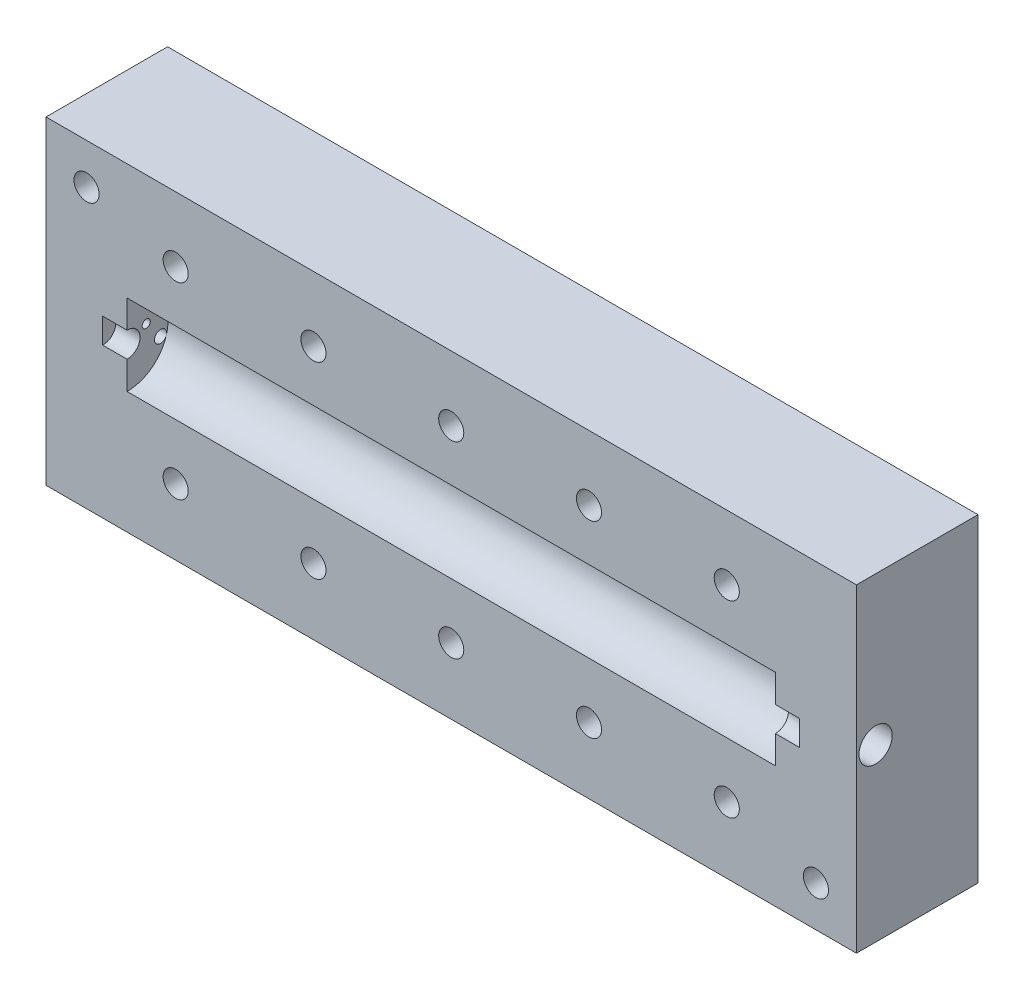
from build123d import *

# Parameters (mm, degrees)
SKIZZE2_W                            = 100
SKIZZE2_H                            = 39.364160046
AUFSATZ_LINEAR_AUSTRAGEN1_DEPTH      = 30
SCHNITT_LINEAR_AUSTRAGEN1_DEPTH      = 40
SCHNITT_LINEAR_AUSTRAGEN1_DEPTH_BACK = 40
SKIZZE10_R                           = 5
SKIZZE17_R                           = 1.55
SCHNITT_LINEAR_AUSTRAGEN2_DEPTH      = 3
SKIZZE24_R                           = 1.55
SCHNITT_LINEAR_AUSTRAGEN4_DEPTH      = 112.577493681
SKIZZE37_R                           = 0.736865544
SCHNITT_LINEAR_AUSTRAGEN9_DEPTH      = 112.577493681
SKIZZE40_R                           = 2.1
SCHNITT_LINEAR_AUSTRAGEN10_DEPTH     = 6
SKIZZE42_R                           = 0.75
SCHNITT_LINEAR_AUSTRAGEN12_DEPTH     = 10
SKIZZE46_R                           = 2.85
SCHNITT_LINEAR_AUSTRAGEN15_DEPTH     = 10
SCHNITT_LINEAR_START                 = -5
SCHNITT_LINEAR_AUSTRAGEN25_DEPTH     = 2.7
LINEARES_MUSTER1_COUNT               = 5
LINEARES_MUSTER1_PITCH               = 17
SPIEGELN2_COPY_1_SKETCH_R            = 2.85
SPIEGELN2_COPY_1_DEPTH               = 10
SPIEGELN2_COPY_2_SKETCH_R            = 2.85
SPIEGELN2_COPY_2_DEPTH               = 10
SPIEGELN2_COPY_3_SKETCH_R            = 2.85
SPIEGELN2_COPY_3_DEPTH               = 10
SPIEGELN2_COPY_4_SKETCH_R            = 2.85
SPIEGELN2_COPY_4_DEPTH               = 10
SPIEGELN2_START                      = -5
SPIEGELN2_COPY_5_DEPTH               = 2.7
SPIEGELN2_COPY_6_DEPTH               = 2.7
SPIEGELN2_COPY_7_DEPTH               = 2.7
SPIEGELN2_COPY_8_DEPTH               = 2.7
SKIZZE51_R                           = 1.55
SCHNITT_LINEAR_AUSTRAGEN26_DEPTH     = 112.577493681
SKIZZE55_R                           = 0.5
SCHNITT_LINEAR_AUSTRAGEN28_DEPTH     = 112.577493681
SKIZZE59_R                           = 2.05
SCHNITT_LINEAR_AUSTRAGEN30_DEPTH     = 5
FASE1_SIZE                           = 1
FASE2_SIZE                           = 1
ABSPALTEN3_SURFACE_1_BACK            = 112.577
ABSPALTEN3_SURFACE_1_DEPTH           = 225.154


with BuildPart() as part:
    # Skizze2 → Aufsatz-Linear austragen1 (new body)
    with BuildSketch(Plane.XY):
        with Locations((50, 19.682080023)):
            Rectangle(SKIZZE2_W, SKIZZE2_H)
    extrude(amount=AUFSATZ_LINEAR_AUSTRAGEN1_DEPTH)

    # Skizze10 → Schnitt-Linear austragen1 (cut, two sides: drawn at the far end of the back side and taken through both)
    with BuildSketch(Plane.ZY.offset(-50).offset(-SCHNITT_LINEAR_AUSTRAGEN1_DEPTH_BACK)):
        with Locations((14.945770016, 20.027045739)):
            Circle(SKIZZE10_R)
    extrude(amount=SCHNITT_LINEAR_AUSTRAGEN1_DEPTH + SCHNITT_LINEAR_AUSTRAGEN1_DEPTH_BACK, mode=Mode.SUBTRACT)

    # Skizze17 → Schnitt-Linear austragen2 (cut)
    with BuildSketch(Plane.ZY.offset(-90)):
        with Locations((14.945770016, 20.027045739)):
            Circle(SKIZZE17_R)
    schnitt_linear_austragen2 = extrude(amount=-SCHNITT_LINEAR_AUSTRAGEN2_DEPTH, mode=Mode.SUBTRACT)

    # Spiegeln1: Schnitt-Linear austragen2 across plane
    add(schnitt_linear_austragen2.mirror(Plane.ZY.offset(-50)), mode=Mode.SUBTRACT)

    # Skizze24 → Schnitt-Linear austragen4 (cut, through all)
    with BuildSketch(Plane.XY.offset(30)):
        with Locations((16, 31.364160046)):
            Circle(SKIZZE24_R)
        with Locations((33, 31.364160046)):
            Circle(SKIZZE24_R)
        with Locations((50, 31.364160046)):
            Circle(SKIZZE24_R)
        with Locations((67, 31.364160046)):
            Circle(SKIZZE24_R)
        with Locations((84, 31.364160046)):
            Circle(SKIZZE24_R)
    schnitt_linear_austragen4 = extrude(amount=-SCHNITT_LINEAR_AUSTRAGEN4_DEPTH, mode=Mode.SUBTRACT)

    # Skizze37 → Schnitt-Linear austragen9 (cut, through all)
    with BuildSketch(Plane(origin=(100, 0, 0), x_dir=(0, 0, -1), z_dir=(1, 0, 0))):
        with Locations((-18.924590299, 18.633559666)):
            Circle(SKIZZE37_R)
    extrude(amount=-SCHNITT_LINEAR_AUSTRAGEN9_DEPTH, mode=Mode.SUBTRACT)

    # Skizze40 → Schnitt-Linear austragen10 (cut)
    with BuildSketch(Plane(origin=(100, 0, 0), x_dir=(0, 0, -1), z_dir=(1, 0, 0))):
        with Locations((-18.924590299, 18.633559666)):
            Circle(SKIZZE40_R)
    extrude(amount=-SCHNITT_LINEAR_AUSTRAGEN10_DEPTH, mode=Mode.SUBTRACT)

    # Skizze42 → Schnitt-Linear austragen12 (cut)
    with BuildSketch(Plane.ZY):
        with Locations((10.86415918, 18.842582577)):
            Circle(SKIZZE42_R)
    extrude(amount=-SCHNITT_LINEAR_AUSTRAGEN12_DEPTH, mode=Mode.SUBTRACT)

    # Skizze46 → Schnitt-Linear austragen15 (cut)
    with BuildSketch(Plane(origin=(0, 0, 0), x_dir=(-1, 0, 0), z_dir=(0, 0, -1))):
        with Locations((-84, 31.364160046)):
            Circle(SKIZZE46_R)
    schnitt_linear_austragen15 = extrude(amount=-SCHNITT_LINEAR_AUSTRAGEN15_DEPTH, mode=Mode.SUBTRACT)

    # Skizze50 → Schnitt-Linear austragen25 (cut)
    with BuildSketch(Plane.XY.offset(30).offset(SCHNITT_LINEAR_START)):
        Polygon((81.15, 33.009608314), (81.15, 39.364160046), (86.85, 39.364160046), (86.85, 33.009608314), (86.85, 29.718711779), (84, 28.073263512), (81.15, 29.718711779), align=None)
    schnitt_linear_austragen25 = extrude(amount=-SCHNITT_LINEAR_AUSTRAGEN25_DEPTH, mode=Mode.SUBTRACT)

    # Lineares Muster1: Schnitt-Linear austragen15, Schnitt-Linear austragen25 ×5
    with Locations(*[(-i * LINEARES_MUSTER1_PITCH, 0, 0) for i in range(1, LINEARES_MUSTER1_COUNT)]):
        add(schnitt_linear_austragen15, mode=Mode.SUBTRACT)
        add(schnitt_linear_austragen25, mode=Mode.SUBTRACT)

    # Spiegeln2: Schnitt-Linear austragen15, Schnitt-Linear austragen25 across plane
    add(schnitt_linear_austragen15.mirror(Plane.ZX.offset(19.764160046)), mode=Mode.SUBTRACT)
    add(schnitt_linear_austragen25.mirror(Plane.ZX.offset(19.764160046)), mode=Mode.SUBTRACT)

    # Spiegeln2 copy 1 sketch → Spiegeln2 copy 1 (cut)
    with BuildSketch(Plane(origin=(-17, 39.528320093, 0), x_dir=(-1, 0, 0), z_dir=(0, 0, -1))):
        with Locations((-84, -31.364160046)):
            Circle(SPIEGELN2_COPY_1_SKETCH_R)
    extrude(amount=-SPIEGELN2_COPY_1_DEPTH, mode=Mode.SUBTRACT)

    # Spiegeln2 copy 2 sketch → Spiegeln2 copy 2 (cut)
    with BuildSketch(Plane(origin=(-34, 39.528320093, 0), x_dir=(-1, 0, 0), z_dir=(0, 0, -1))):
        with Locations((-84, -31.364160046)):
            Circle(SPIEGELN2_COPY_2_SKETCH_R)
    extrude(amount=-SPIEGELN2_COPY_2_DEPTH, mode=Mode.SUBTRACT)

    # Spiegeln2 copy 3 sketch → Spiegeln2 copy 3 (cut)
    with BuildSketch(Plane(origin=(-51, 39.528320093, 0), x_dir=(-1, 0, 0), z_dir=(0, 0, -1))):
        with Locations((-84, -31.364160046)):
            Circle(SPIEGELN2_COPY_3_SKETCH_R)
    extrude(amount=-SPIEGELN2_COPY_3_DEPTH, mode=Mode.SUBTRACT)

    # Spiegeln2 copy 4 sketch → Spiegeln2 copy 4 (cut)
    with BuildSketch(Plane(origin=(-68, 39.528320093, 0), x_dir=(-1, 0, 0), z_dir=(0, 0, -1))):
        with Locations((-84, -31.364160046)):
            Circle(SPIEGELN2_COPY_4_SKETCH_R)
    extrude(amount=-SPIEGELN2_COPY_4_DEPTH, mode=Mode.SUBTRACT)

    # Spiegeln2 copy 5 sketch → Spiegeln2 copy 5 (cut)
    with BuildSketch(Plane(origin=(-17, 39.528320093, 30), x_dir=(1, 0, 0), z_dir=(0, 0, 1)).offset(SPIEGELN2_START)):
        Polygon((81.15, -33.009608314), (81.15, -39.364160046), (86.85, -39.364160046), (86.85, -33.009608314), (86.85, -29.718711779), (84, -28.073263512), (81.15, -29.718711779), align=None)
    extrude(amount=-SPIEGELN2_COPY_5_DEPTH, mode=Mode.SUBTRACT)

    # Spiegeln2 copy 6 sketch → Spiegeln2 copy 6 (cut)
    with BuildSketch(Plane(origin=(-34, 39.528320093, 30), x_dir=(1, 0, 0), z_dir=(0, 0, 1)).offset(SPIEGELN2_START)):
        Polygon((81.15, -33.009608314), (81.15, -39.364160046), (86.85, -39.364160046), (86.85, -33.009608314), (86.85, -29.718711779), (84, -28.073263512), (81.15, -29.718711779), align=None)
    extrude(amount=-SPIEGELN2_COPY_6_DEPTH, mode=Mode.SUBTRACT)

    # Spiegeln2 copy 7 sketch → Spiegeln2 copy 7 (cut)
    with BuildSketch(Plane(origin=(-51, 39.528320093, 30), x_dir=(1, 0, 0), z_dir=(0, 0, 1)).offset(SPIEGELN2_START)):
        Polygon((81.15, -33.009608314), (81.15, -39.364160046), (86.85, -39.364160046), (86.85, -33.009608314), (86.85, -29.718711779), (84, -28.073263512), (81.15, -29.718711779), align=None)
    extrude(amount=-SPIEGELN2_COPY_7_DEPTH, mode=Mode.SUBTRACT)

    # Spiegeln2 copy 8 sketch → Spiegeln2 copy 8 (cut)
    with BuildSketch(Plane(origin=(-68, 39.528320093, 30), x_dir=(1, 0, 0), z_dir=(0, 0, 1)).offset(SPIEGELN2_START)):
        Polygon((81.15, -33.009608314), (81.15, -39.364160046), (86.85, -39.364160046), (86.85, -33.009608314), (86.85, -29.718711779), (84, -28.073263512), (81.15, -29.718711779), align=None)
    extrude(amount=-SPIEGELN2_COPY_8_DEPTH, mode=Mode.SUBTRACT)

    # Spiegeln3: Schnitt-Linear austragen4 across plane
    add(schnitt_linear_austragen4.mirror(Plane.ZX.offset(19.764160046)), mode=Mode.SUBTRACT)

    # Skizze51 → Schnitt-Linear austragen26 (cut, through all)
    with BuildSketch(Plane.XY.offset(30)):
        with Locations((5, 34.364160046)):
            Circle(SKIZZE51_R)
        with Locations((95, 5)):
            Circle(SKIZZE51_R)
    extrude(amount=-SCHNITT_LINEAR_AUSTRAGEN26_DEPTH, mode=Mode.SUBTRACT)

    # Skizze55 → Schnitt-Linear austragen28 (cut, through all)
    with BuildSketch(Plane(origin=(100, 0, 0), x_dir=(0, 0, -1), z_dir=(1, 0, 0))):
        with Locations((-12.633679338, 21.083160509)):
            Circle(SKIZZE55_R)
    extrude(amount=-SCHNITT_LINEAR_AUSTRAGEN28_DEPTH, mode=Mode.SUBTRACT)

    # Skizze59 → Schnitt-Linear austragen30 (cut)
    with BuildSketch(Plane(origin=(100, 0, 0), x_dir=(0, 0, -1), z_dir=(1, 0, 0))):
        with Locations((-12.633679338, 21.083160509)):
            Circle(SKIZZE59_R)
    extrude(amount=-SCHNITT_LINEAR_AUSTRAGEN30_DEPTH, mode=Mode.SUBTRACT)

    # Fase1
    fase1_edges = [part.edges().sort_by_distance(p)[0] for p in [
        (94, 18.633559666, 19.661455843),
    ]]
    chamfer(fase1_edges, length=FASE1_SIZE)

    # Fase2
    fase2_edges = [part.edges().sort_by_distance(p)[0] for p in [
        (95, 21.083160509, 13.133679338),
    ]]
    chamfer(fase2_edges, length=FASE2_SIZE)

    # Abspalten3: cut with a surface, the side behind it stays
    # Abspalten3 surface: a surface, the sketch's curves swept straight by 225.154 mm
    with BuildLine(Plane(origin=(100, 0, 0), x_dir=(0, 0, -1), z_dir=(1, 0, 0)).offset(-ABSPALTEN3_SURFACE_1_BACK), mode=Mode.PRIVATE) as abspalten3_surface_1_path:
        Line((-15, 39.364160046), (0, 39.364160046))
        Line((0, 39.364160046), (0, 0))
        Line((0, 0), (-15, 0))
        Line((-15, 0), (-15, 39.364160046))
    abspalten3_surface_1 = Shell.extrude(abspalten3_surface_1_path.wire(), (1 * ABSPALTEN3_SURFACE_1_DEPTH, 0 * ABSPALTEN3_SURFACE_1_DEPTH, 0 * ABSPALTEN3_SURFACE_1_DEPTH))
    split(bisect_by=abspalten3_surface_1, keep=Keep.BOTTOM)


solid = part.part
